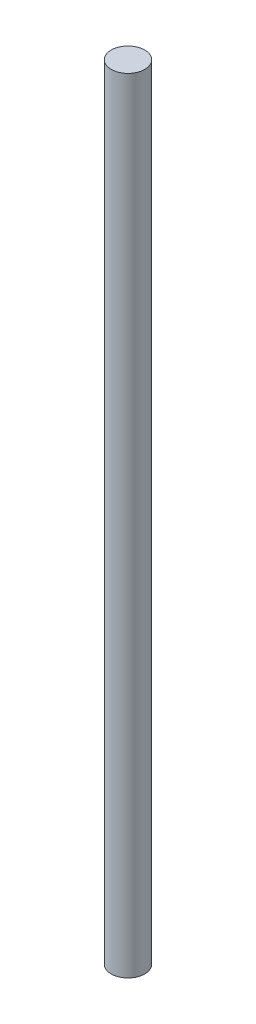
from build123d import *

# Parameters (mm, degrees)
SKETCH1_R           = 15
BOSS_EXTRUDE1_DEPTH = 700


with BuildPart() as part:
    # Sketch1 → Boss-Extrude1 (new body)
    with BuildSketch(Plane(origin=(0, 0, 0), x_dir=(1, 0, 0), z_dir=(0, 1, 0))):
        with Locations(Location((0, 0, 0), (0, 0, 270))):
            Circle(SKETCH1_R)
    extrude(amount=BOSS_EXTRUDE1_DEPTH)


solid = part.part
